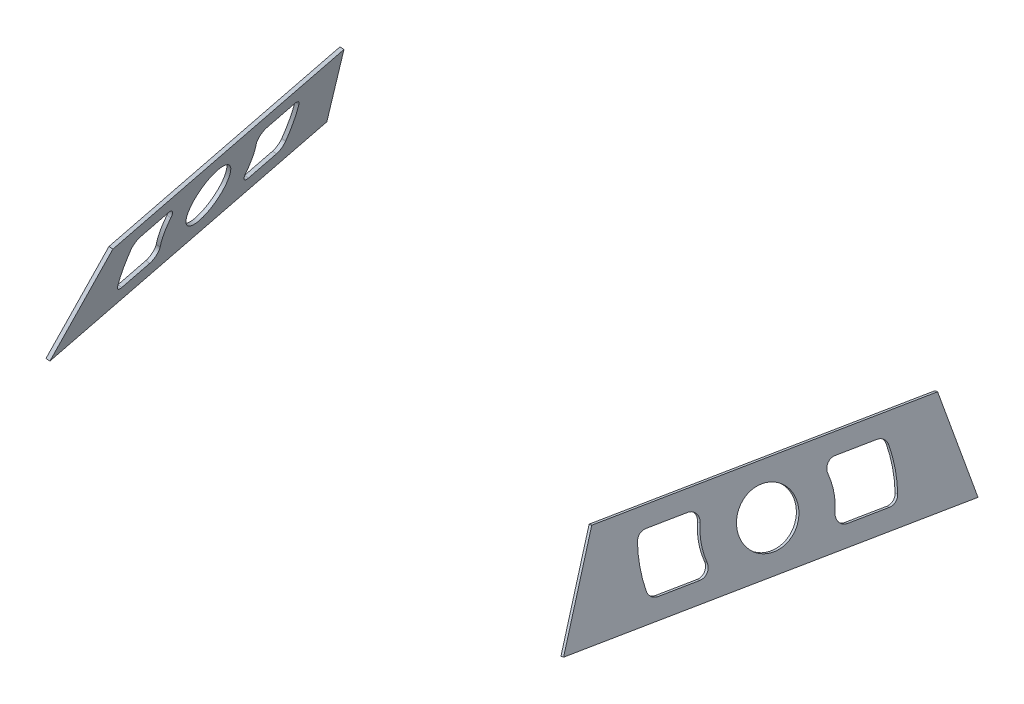
from build123d import *

# Parameters (mm, degrees)
BOSS_EXTRUDE1_DEPTH     = 2
CUT_EXTRUDE4_DEPTH      = 1783.373892428
CUT_EXTRUDE4_DEPTH_BACK = 1783.373892428
SKETCH3_R               = 15
CUT_EXTRUDE5_DEPTH      = 1783.287445841
CUT_EXTRUDE5_DEPTH_BACK = 1783.287445841


with BuildPart() as part:
    # Sketch1 → Boss-Extrude1 (new body)
    with BuildSketch(Plane(origin=(-659.614198676, 210.630673215, 131.193827815), x_dir=(-0.17733557040624176, 0.056627511437048535, -0.9825199338523061), z_dir=(0.9359591821601224, -0.2988742708017783, -0.1861574053935545))):
        Polygon((-1393.93126095, 796.442353721), (-1387.107384854, 745.948447334), (-1589.678471357, 757.99020856), (-1562.978977596, 806.49133097), align=None)
    extrude(amount=-BOSS_EXTRUDE1_DEPTH)

    # Sketch3 → Cut-Extrude4 (cut, two sides: drawn at the far end of the back side and taken through both)
    with BuildSketch(Plane(origin=(-647.727517063, 206.834969975, 128.829628767), x_dir=(-0.17733557040624176, 0.056627511437048535, -0.9825199338523061), z_dir=(0.9359591821601224, -0.2988742708017783, -0.1861574053935545)).offset(-CUT_EXTRUDE4_DEPTH_BACK)):
        with Locations(Location((-1483.424023689, 776.718085146, 0), (0, 0, 270))):
            Circle(SKETCH3_R)
    extrude(amount=CUT_EXTRUDE4_DEPTH + CUT_EXTRUDE4_DEPTH_BACK, mode=Mode.SUBTRACT)

    # Sketch6 → Cut-Extrude5 (cut, two sides: drawn at the far end of the back side and taken through both)
    with BuildSketch(Plane(origin=(-661.48611704, 211.228421756, 131.566142626), x_dir=(0.17733557040624248, -0.05662751143704847, 0.982519933852306), z_dir=(-0.9359591821601227, 0.298874270801777, 0.1861574053935552)).offset(-CUT_EXTRUDE5_DEPTH_BACK)):
        with BuildLine():
            Line((1446.574766594, 789.554074167), (1426.116791028, 788.337957587))
            ThreePointArc((1426.116791028, 788.337957587), (1422.982372867, 786.983722163), (1421.448026269, 783.933425242))
            ThreePointArc((1421.448026269, 783.933425242), (1421.118544819, 773.027161308), (1422.690830395, 762.229797319))
            ThreePointArc((1422.690830395, 762.229797319), (1424.572057657, 759.368085016), (1427.853569511, 758.388241524))
            Line((1427.853569511, 758.388241524), (1448.286940124, 759.602895472))
            ThreePointArc((1448.286940124, 759.602895472), (1452.137251214, 761.800824117), (1452.727052349, 766.194902))
            ThreePointArc((1452.727052349, 766.194902), (1451.067215368, 774.782216154), (1451.757447486, 783.501195612))
            ThreePointArc((1451.757447486, 783.501195612), (1450.66945389, 787.814851695), (1446.574766594, 789.554074167))
        make_face()
        with BuildLine():
            Line((1518.663078212, 793.839336445), (1539.121053778, 795.055453025))
            ThreePointArc((1539.121053778, 795.055453025), (1542.393835076, 794.082091137), (1544.27874665, 791.235050718))
            ThreePointArc((1544.27874665, 791.235050718), (1545.897979428, 780.44462736), (1545.615936818, 769.537033538))
            ThreePointArc((1545.615936818, 769.537033538), (1544.086986772, 766.472604542), (1540.94466742, 765.110898845))
            Line((1540.94466742, 765.110898845), (1520.511296807, 763.896244898))
            ThreePointArc((1520.511296807, 763.896244898), (1516.427711366, 765.622546079), (1515.321494808, 769.915804836))
            ThreePointArc((1515.321494808, 769.915804836), (1515.952298188, 778.639285235), (1514.233984221, 787.215089587))
            ThreePointArc((1514.233984221, 787.215089587), (1514.803274243, 791.627262264), (1518.663078212, 793.839336445))
        make_face()
    extrude(amount=CUT_EXTRUDE5_DEPTH + CUT_EXTRUDE5_DEPTH_BACK, mode=Mode.SUBTRACT)


with BuildPart() as body_2:
    # Mirror5: mirrored copy
    add(part.part.mirror(Plane(origin=(0, 0, 0), x_dir=(0, 0, 1), z_dir=(1, 0, 0))))


solid = Compound([part.part, body_2.part])
